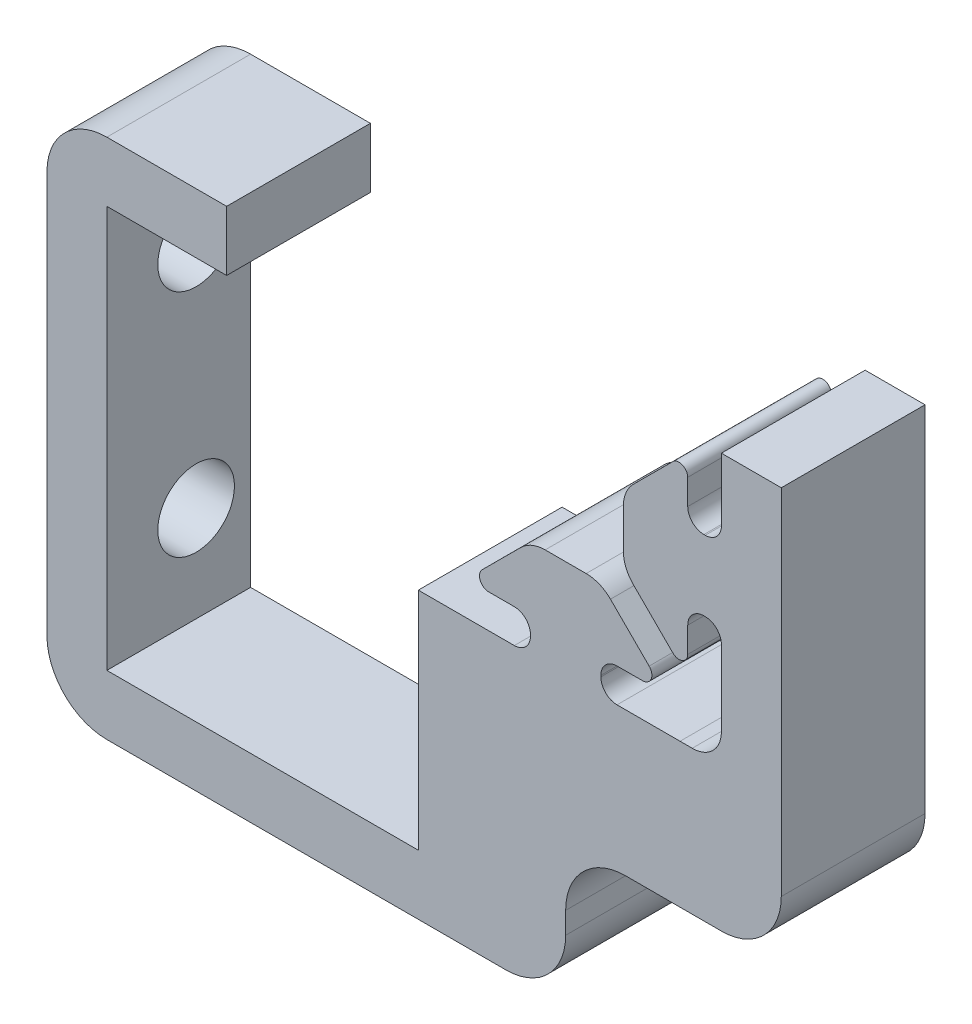
from build123d import *

# Parameters (mm, degrees)
BOSS_EXTRUDE1_DEPTH     = 12
FILLET1_R               = 5
FILLET2_R               = 5
CUT_EXTRUDE1_REACH      = 74.499
SKETCH3_R               = 3.2
CHAMFER1_SIZE           = 0.2
CUT_EXTRUDE2_DEPTH      = 76.419667653
CUT_EXTRUDE2_DEPTH_BACK = 76.419667653
SKETCH4_W               = 23.729387498
SKETCH4_H               = 55.299704447


with BuildPart() as part:
    # Sketch2 → Boss-Extrude1 (new body)
    with BuildSketch(Plane.XY):
        with BuildLine():
            Line((-10.5918, -13), (-5.317126718, -13))
            Line((-5.317126718, -13), (-4.287512407, -13))
            ThreePointArc((-4.287512407, -13), (-3.333616586, -12.604883414), (-2.9385, -11.650987593))
            Line((-2.9385, -11.650987593), (-2.9385, -11.539212407))
            ThreePointArc((-2.9385, -11.539212407), (-3.333616586, -10.585316586), (-4.287512407, -10.1902))
            Line((-4.287512407, -10.1902), (-6.416408329, -10.1902))
            ThreePointArc((-6.416408329, -10.1902), (-7.137514675, -9.708134418), (-6.967711912, -8.857517813))
            Line((-6.967711912, -8.857517813), (-3.740331666, -5.636015806))
            ThreePointArc((-3.740331666, -5.636015806), (-2.808257752, -5.01414519), (-1.709253557, -4.7958))
            Line((-1.709253557, -4.7958), (1.709253557, -4.7958))
            ThreePointArc((1.709253557, -4.7958), (2.808257752, -5.01414519), (3.740331666, -5.636015806))
            Line((3.740331666, -5.636015806), (6.967711912, -8.857517813))
            ThreePointArc((6.967711912, -8.857517813), (7.137514675, -9.708134418), (6.416408329, -10.1902))
            Line((6.416408329, -10.1902), (4.287512407, -10.1902))
            ThreePointArc((4.287512407, -10.1902), (3.333616586, -10.585316586), (2.9385, -11.539212407))
            Line((2.9385, -11.539212407), (2.9385, -11.650987593))
            ThreePointArc((2.9385, -11.650987593), (3.333616586, -12.604883414), (4.287512407, -13))
            Line((4.287512407, -13), (5.317126718, -13))
            Line((5.317126718, -13), (9.550465633, -13))
            Line((9.550465633, -13), (10.564722121, -12.999847763))
            ThreePointArc((10.564722121, -12.999847763), (12.294654751, -12.29465435), (12.999847757, -10.564721553))
            Line((12.999847757, -10.564721553), (13, -9.550422515))
            Line((13, -9.550422515), (13, -6.3330836))
            Line((13, -6.3330836), (13, -5.3170836))
            Line((13, -5.3170836), (13, -4.287469289))
            ThreePointArc((13, -4.287469289), (12.604883414, -3.333573468), (11.650987593, -2.938456882))
            Line((11.650987593, -2.938456882), (11.539212407, -2.938456882))
            ThreePointArc((11.539212407, -2.938456882), (10.585316586, -3.333573468), (10.1902, -4.287469289))
            Line((10.1902, -4.287469289), (10.1902, -6.402089023))
            ThreePointArc((10.1902, -6.402089023), (9.74154152, -7.073969797), (8.94902056, -6.917034355))
            Line((8.94902056, -6.917034355), (5.652895046, -3.628441884))
            ThreePointArc((5.652895046, -3.628441884), (5.027976112, -2.694919539), (4.8085, -1.593185507))
            Line((4.8085, -1.593185507), (4.8085, 1.593185507))
            ThreePointArc((4.8085, 1.593185507), (5.027976112, 2.694919539), (5.652895046, 3.628441884))
            Line((5.652895046, 3.628441884), (8.94902056, 6.917034355))
            ThreePointArc((8.94902056, 6.917034355), (9.74154152, 7.073969797), (10.1902, 6.402089023))
            Line((10.1902, 6.402089023), (10.1902, 4.287469289))
            ThreePointArc((10.1902, 4.287469289), (10.585316586, 3.333573468), (11.539212407, 2.938456882))
            Line((11.539212407, 2.938456882), (11.650987593, 2.938456882))
            ThreePointArc((11.650987593, 2.938456882), (12.604883414, 3.333573468), (13, 4.287469289))
            Line((13, 4.287469289), (13, 5.3170836))
            Line((13, 5.3170836), (13, 6.3330836))
            Line((13, 6.3330836), (13, 9.550422515))
            Line((13, 9.550422515), (18, 9.550422515))
            Line((18, 9.550422515), (18, -25))
            Line((18, -25), (0, -25))
            Line((0, -25), (0, -36.8026666))
            Line((0, -36.8026666), (-12, -36.8026666))
            Line((-12, -36.8026666), (-43.3, -36.8026666))
            Line((-43.3, -36.8026666), (-43.3, -31.8026666))
            Line((-43.3, -31.8026666), (-43.3, 6.7473334))
            Line((-43.3, 6.7473334), (-28.3, 6.7473334))
            Line((-28.3, 6.7473334), (-28.3, 1.7473334))
            Line((-28.3, 1.7473334), (-38.3, 1.7473334))
            Line((-38.3, 1.7473334), (-38.3, -31.8026666))
            Line((-38.3, -31.8026666), (-12.3, -31.8026666))
            Line((-12.3, -31.8026666), (-12.3, -13))
            Line((-12.3, -13), (-10.5918, -13))
        make_face()
    extrude(amount=BOSS_EXTRUDE1_DEPTH)

    # Fillet1
    fillet1_edges = [part.edges().sort_by_distance(p)[0] for p in [
        (0, -36.8026666, 6),
        (18, -25, 6),
        (0, -25, 6),
    ]]
    fillet(fillet1_edges, radius=FILLET1_R)

    # Fillet2
    fillet2_edges = [part.edges().sort_by_distance(p)[0] for p in [
        (-43.3, -36.8026666, 6),
        (-43.3, 6.7473334, 6),
    ]]
    fillet(fillet2_edges, radius=FILLET2_R)

    # Sketch3 → Cut-Extrude1 (cut, up to next)
    with BuildSketch(Plane.ZY.offset(43.3), mode=Mode.PRIVATE) as cut_extrude1_sk1:
        with Locations((7.45, -23.7926666)):
            Circle(SKETCH3_R)
    cut_extrude1_tool1 = extrude(cut_extrude1_sk1.sketch, amount=-CUT_EXTRUDE1_REACH, mode=Mode.PRIVATE) & part.part
    # Sketch3 → Cut-Extrude1 (cut, up to next)
    with BuildSketch(Plane.ZY.offset(43.3), mode=Mode.PRIVATE) as cut_extrude1_sk2:
        with Locations((7.45, -4.5926666)):
            Circle(SKETCH3_R)
    cut_extrude1_tool2 = extrude(cut_extrude1_sk2.sketch, amount=-CUT_EXTRUDE1_REACH, mode=Mode.PRIVATE) & part.part
    add(cut_extrude1_tool1.solids().sort_by_distance((-43.3, -23.792667, 7.45))[0], mode=Mode.SUBTRACT)
    add(cut_extrude1_tool2.solids().sort_by_distance((-43.3, -4.592667, 7.45))[0], mode=Mode.SUBTRACT)

    # Chamfer1
    chamfer1_edges = [part.edges().sort_by_distance(p)[0] for p in [
        (-43.3, -23.7926666, 4.25),
        (-43.3, -4.5926666, 4.25),
    ]]
    chamfer(chamfer1_edges, length=CHAMFER1_SIZE)


with BuildPart() as body_2:
    # Mirror1: mirrored copy
    add(part.part.mirror(Plane(origin=(11.650987593, 4.287469289, 12), x_dir=(1, 0, 0), z_dir=(0, 0, 1))))


with BuildPart() as part_1:
    add(part.part)

    # Sketch4 → Cut-Extrude2 (cut, two sides: drawn at the far end of the back side and taken through both)
    with BuildSketch(Plane.ZY.offset(43.3).offset(-CUT_EXTRUDE2_DEPTH_BACK)):
        with Locations((0.135306251, -13.030919745)):
            Rectangle(SKETCH4_W, SKETCH4_H)
    extrude(amount=CUT_EXTRUDE2_DEPTH + CUT_EXTRUDE2_DEPTH_BACK, mode=Mode.SUBTRACT)


solid = body_2.part
